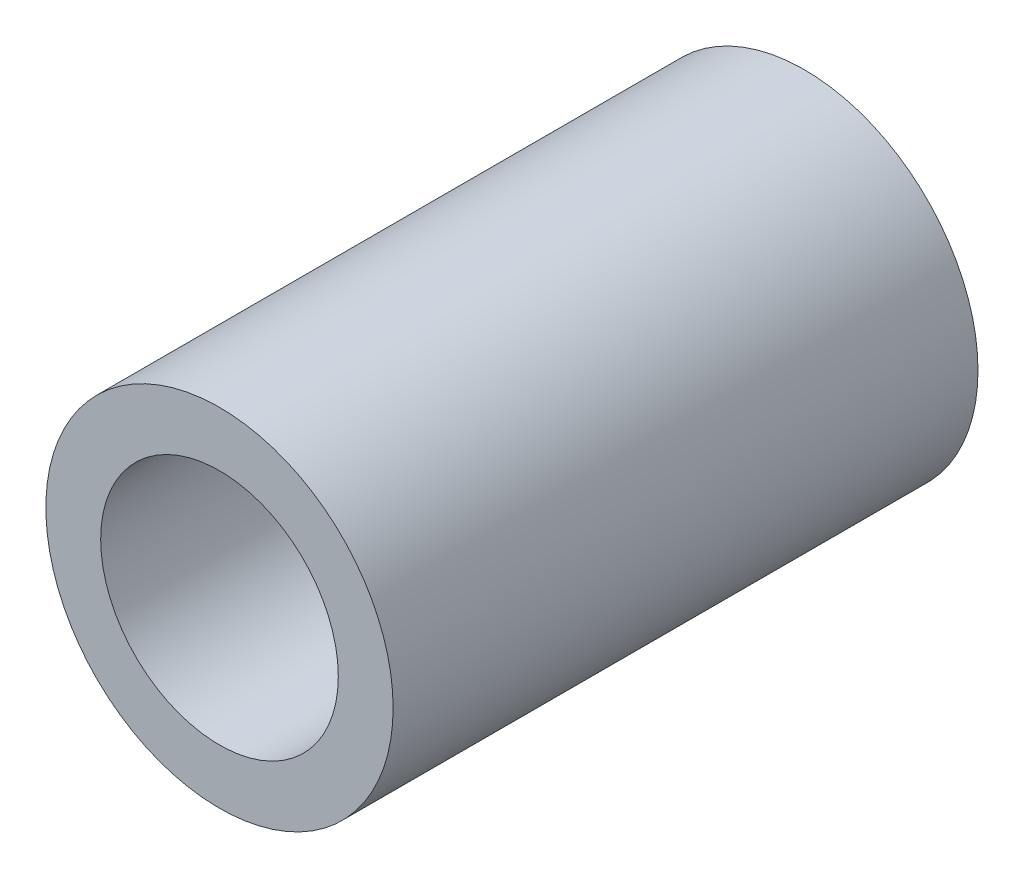
from build123d import *

# Parameters (mm, degrees)
SKETCH1_R           = 4.75
SKETCH1_R_2         = 3.25
BOSS_EXTRUDE1_DEPTH = 16


with BuildPart() as part:
    # Sketch1 → Boss-Extrude1 (new body)
    with BuildSketch(Plane.XY):
        Circle(SKETCH1_R)
        Circle(SKETCH1_R_2, mode=Mode.SUBTRACT)
    extrude(amount=BOSS_EXTRUDE1_DEPTH)


solid = part.part
